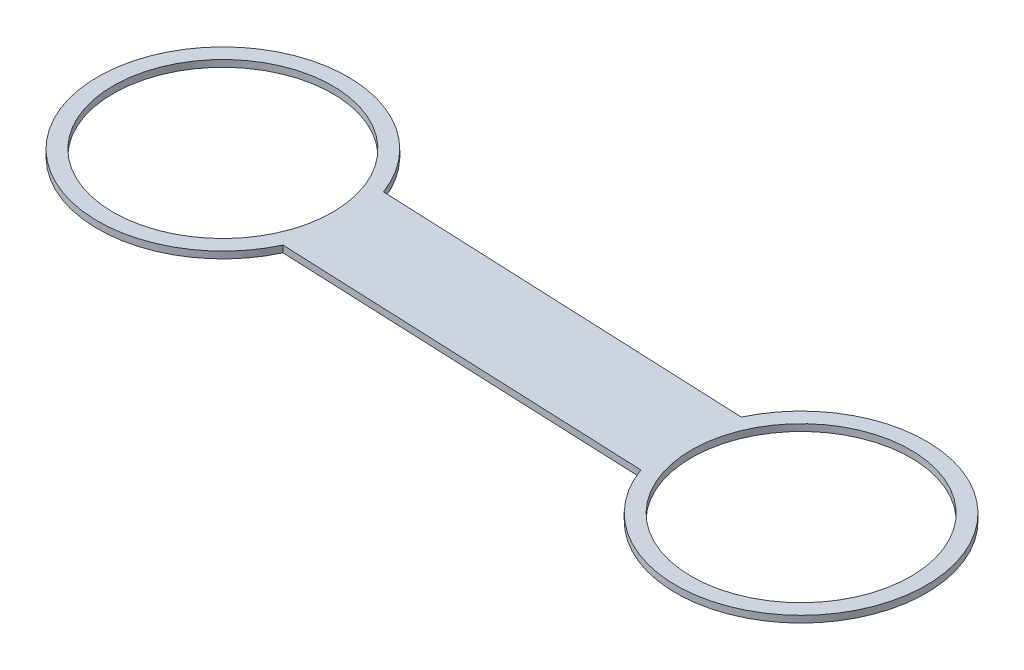
from build123d import *

# Parameters (mm, degrees)
SKETCH1_R           = 32.4358
BOSS_EXTRUDE1_DEPTH = 2


with BuildPart() as part:
    # Sketch1 → Boss-Extrude1 (new body)
    with BuildSketch(Plane(origin=(0, 0, 0), x_dir=(1, 0, 0), z_dir=(0, 1, 0))):
        with BuildLine():
            Line((34.724455341, 12.775453074), (145.341023247, 8.00004525))
            ThreePointArc((145.341023247, 8.00004525), (215.771836356, -9.474231493), (144.033066178, -20.401199793))
            Line((144.033066178, -20.401199793), (33.495414057, -15.718054496))
            ThreePointArc((33.495414057, -15.718054496), (-36.965627799, 1.594478411), (34.724455341, 12.775453074))
        make_face()
        with Locations(Location((0, 0, 0), (0, 0, 270))):
            Circle(SKETCH1_R, mode=Mode.SUBTRACT)
        with Locations(Location((178.811009986, -7.772081673, 0), (0, 0, 270))):
            Circle(SKETCH1_R, mode=Mode.SUBTRACT)
    extrude(amount=BOSS_EXTRUDE1_DEPTH)


solid = part.part
